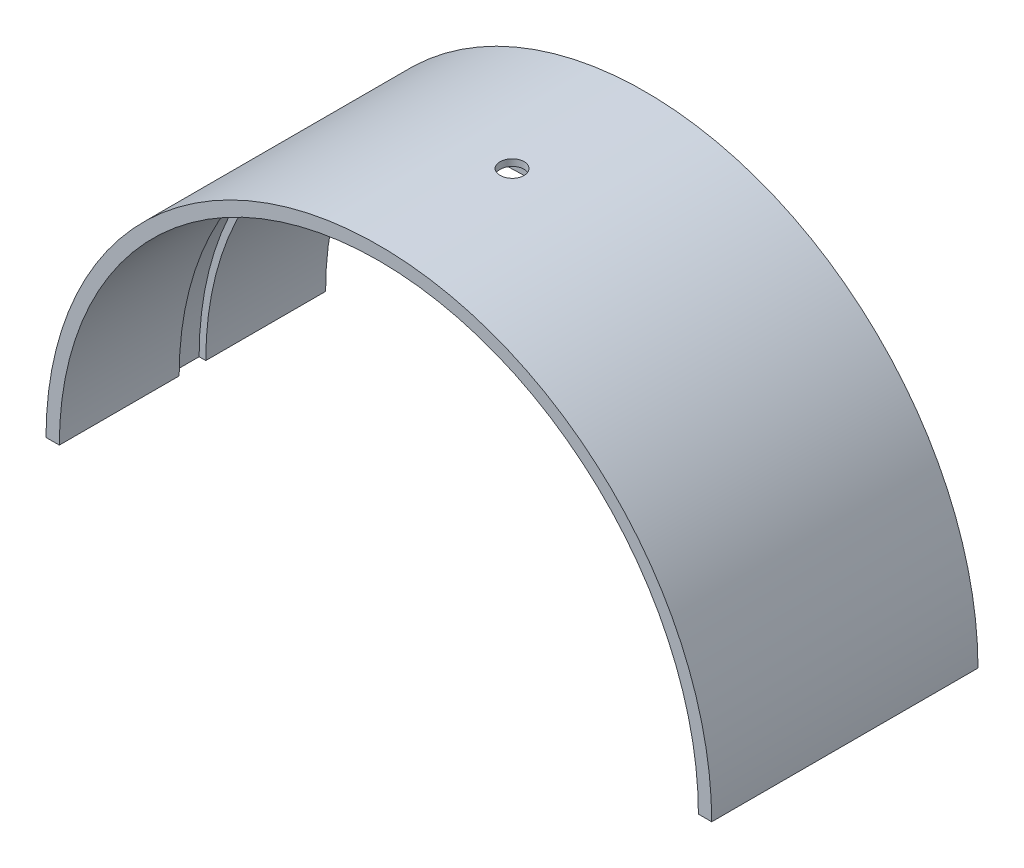
from build123d import *

# Parameters (mm, degrees)
REVOLVE1_ANGLE     = 180
SKETCH2_R          = 0.9
CUT_EXTRUDE2_DEPTH = 37.742346142


with BuildPart() as part:
    # Sketch1 → Revolve1 (revolve)
    with BuildSketch(Plane(origin=(0, 0, 0), x_dir=(1, 0, 0), z_dir=(0, 1, 0))):
        Polygon((25, -10), (25, 10), (24, 10), (24, 1), (24.5, 1), (24.5, -1), (24, -1), (24, -10), align=None)
    revolve(axis=Axis((0, 0, -11.525756711), (0, 0, 1)), revolution_arc=REVOLVE1_ANGLE)

    # Sketch2 → Cut-Extrude2 (cut, through all)
    with BuildSketch(Plane(origin=(0, 0, 0), x_dir=(1, 0, 0), z_dir=(0, 1, 0))):
        with Locations(Location((0, 0, 0), (0, 0, 90))):
            Circle(SKETCH2_R)
    extrude(amount=CUT_EXTRUDE2_DEPTH, mode=Mode.SUBTRACT)


solid = part.part
